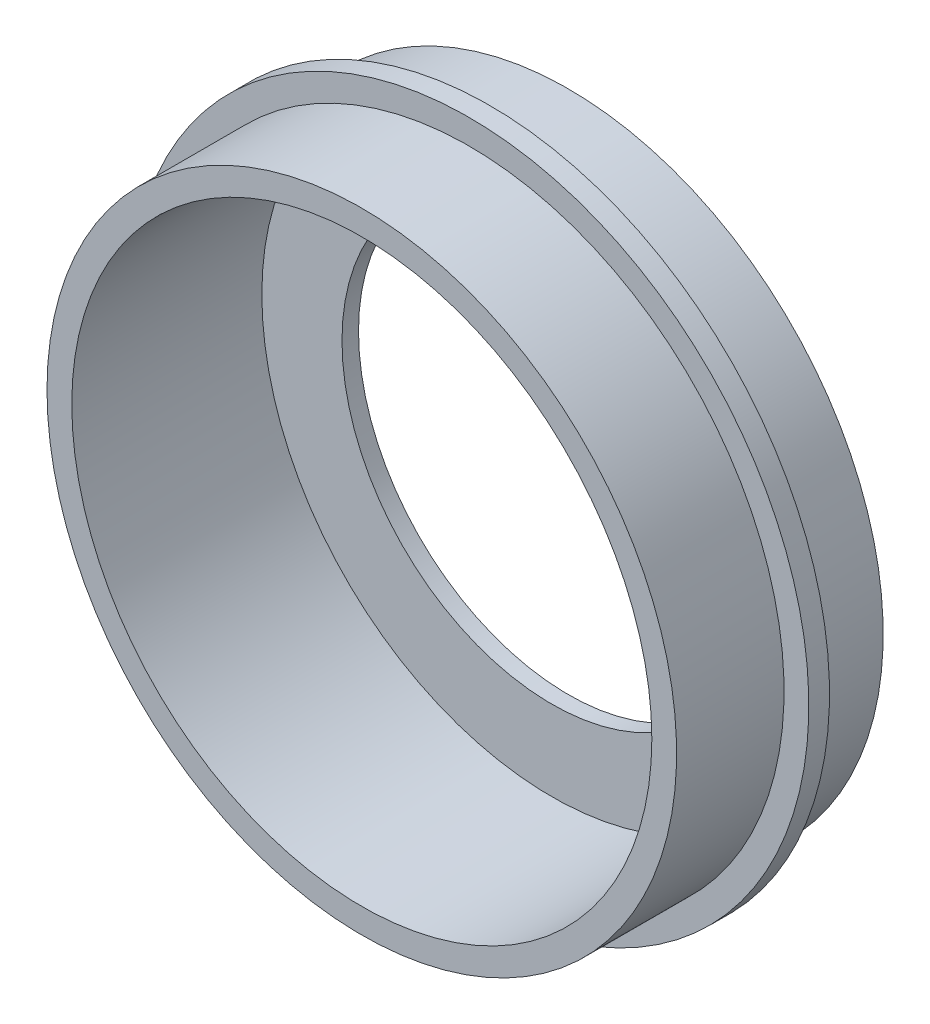
from build123d import *


with BuildPart() as part:
    # Sketch6 → Revolve1 (revolve)
    with BuildSketch(Plane(origin=(0, 0, 0), x_dir=(0, 0, -1), z_dir=(1, 0, 0)), mode=Mode.PRIVATE) as revolve1_sk:
        Polygon((0, 25.4), (-2, 25.4), (-2, 35.1), (-25, 35.1), (-25, 38.1), (-12, 38.1), (-12, 41.1), (-9.5, 41.1), (-9.5, 38.1), (0, 38.1), align=None)
    revolve(revolve1_sk.sketch.rotate(Axis((0, 0, 0), (0, 0, 1)), 90), axis=Axis((0, 0, 0), (0, 0, 1)))


solid = part.part
